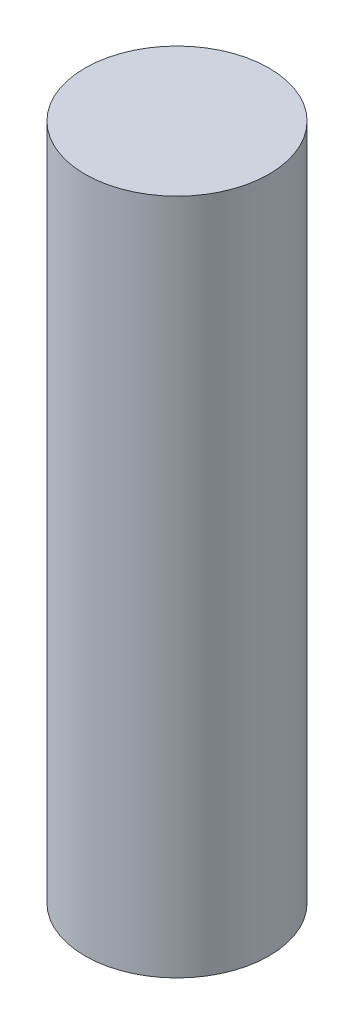
from build123d import *

# Parameters (mm, degrees)
SKETCH1_R           = 2.5
BOSS_EXTRUDE1_DEPTH = 18.4


with BuildPart() as part:
    # Sketch1 → Boss-Extrude1 (new body)
    with BuildSketch(Plane(origin=(0, 0, 0), x_dir=(1, 0, 0), z_dir=(0, 1, 0))):
        with Locations(Location((0, 0, 0), (0, 0, 270))):
            Circle(SKETCH1_R)
    extrude(amount=BOSS_EXTRUDE1_DEPTH)


solid = part.part
